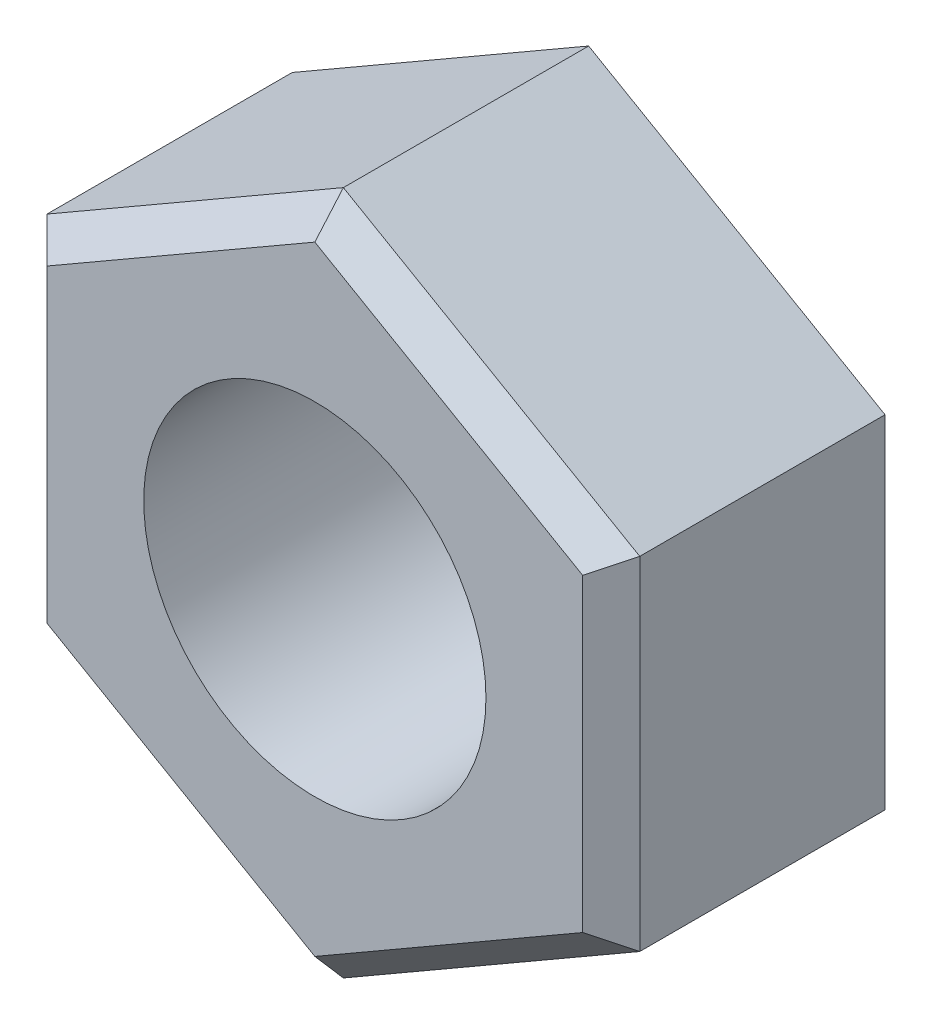
from build123d import *

# Parameters (mm, degrees)
ESQUISSE1_R        = 1.5
BOSS_EXTRU_1_DEPTH = 2.4
CHANFREIN1_SIZE    = 0.25


with BuildPart() as part:
    # Esquisse1 → Boss.-Extru.1 (new body)
    with BuildSketch(Plane.XY):
        Polygon((0, -3), (2.598076211, -1.5), (2.598076211, 1.5), (0, 3), (-2.598076211, 1.5), (-2.598076211, -1.5), align=None)
        Circle(ESQUISSE1_R, mode=Mode.SUBTRACT)
    extrude(amount=BOSS_EXTRU_1_DEPTH)

    # Chanfrein1
    chanfrein1_edges = [part.edges().sort_by_distance(p)[0] for p in [
        (2.598076211, 0, 2.4),
        (1.299038106, 2.25, 2.4),
        (-1.299038106, 2.25, 2.4),
        (-2.598076211, 0, 2.4),
        (-1.299038106, -2.25, 2.4),
        (1.299038106, -2.25, 2.4),
    ]]
    chamfer(chanfrein1_edges, length=CHANFREIN1_SIZE)


solid = part.part
